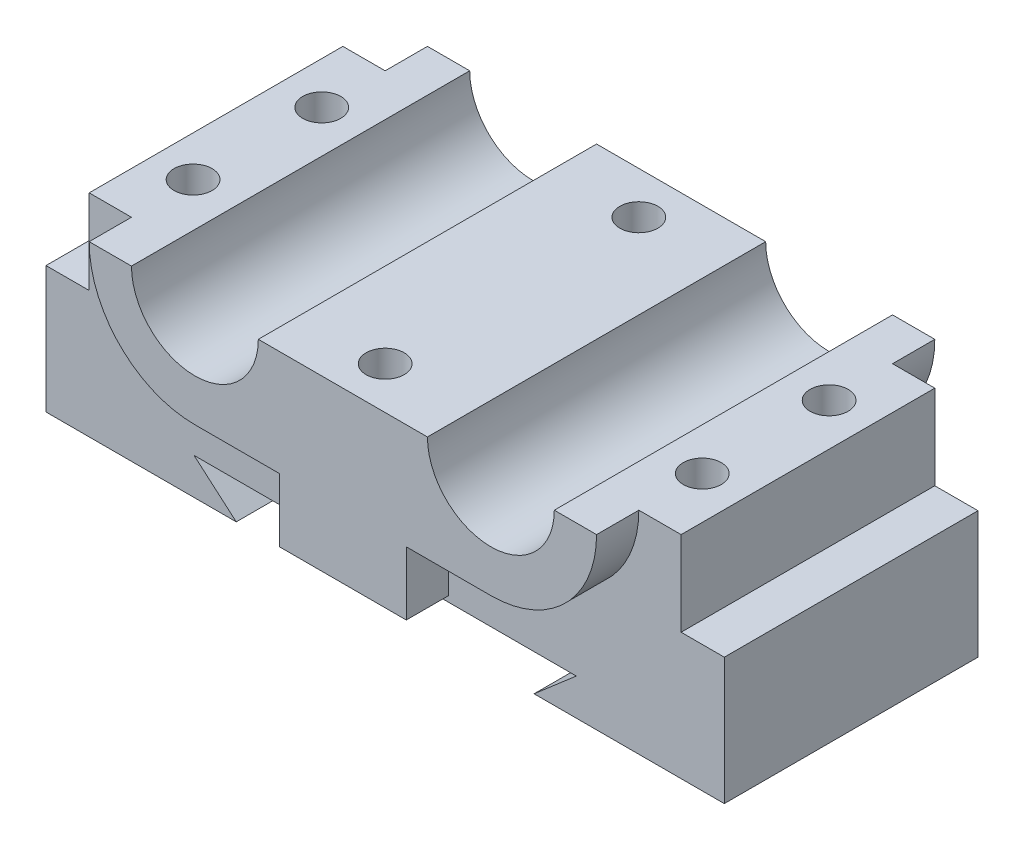
from build123d import *

# Parameters (mm, degrees)
BOSS_EXTRUDE1_DEPTH       = 20
BOSS_EXTRUDE2_DEPTH       = 15
F_3_0MM_DOWEL_HOLE1_D     = 4.5
F_3_0MM_DOWEL_HOLE1_DEPTH = 15
F_3_0MM_DOWEL_HOLE1_TIP   = 1.351936393


with BuildPart() as part:
    # Sketch1 → Boss-Extrude1 (new, symmetric)
    with BuildSketch(Plane.XY):
        with BuildLine():
            Line((-30, 0), (-25, 0))
            ThreePointArc((-25, 0), (-17.5, -7.5), (-10, 0))
            Line((-10, 0), (10, 0))
            ThreePointArc((10, 0), (17.5, -7.5), (25, 0))
            Line((25, 0), (30, 0))
            ThreePointArc((30, 0), (26.338834765, -8.838834765), (17.5, -12.5))
            Line((17.5, -12.5), (7.5, -12.5))
            Line((7.5, -12.5), (7.5, -20))
            Line((7.5, -20), (-7.5, -20))
            Line((-7.5, -20), (-7.5, -12.5))
            Line((-7.5, -12.5), (-17.5, -12.5))
            ThreePointArc((-17.5, -12.5), (-26.338834765, -8.838834765), (-30, 0))
        make_face()
    extrude(amount=BOSS_EXTRUDE1_DEPTH, both=True)

    # Sketch6 → Boss-Extrude2 (add, symmetric)
    with BuildSketch(Plane.XY):
        with BuildLine():
            Line((-35, 0), (-35, -10))
            Line((-35, -10), (-40.106769961, -10))
            Line((-40.106769961, -10), (-40.106769961, -25))
            Line((-40.106769961, -25), (-17.606769961, -25))
            Line((-17.606769961, -25), (-22.606769961, -20.683563485))
            Line((-22.606769961, -20.683563485), (22.606769961, -20.683563485))
            Line((22.606769961, -20.683563485), (17.606769961, -25))
            Line((17.606769961, -25), (40.106769961, -25))
            Line((40.106769961, -25), (40.106769961, -10))
            Line((40.106769961, -10), (35, -10))
            Line((35, -10), (35, 0))
            Line((35, 0), (30, 0))
            ThreePointArc((30, 0), (26.338834765, -8.838834765), (17.5, -12.5))
            Line((17.5, -12.5), (7.5, -12.5))
            Line((7.5, -12.5), (7.5, -20))
            Line((7.5, -20), (-7.5, -20))
            Line((-7.5, -20), (-7.5, -12.5))
            Line((-7.5, -12.5), (-17.5, -12.5))
            ThreePointArc((-17.5, -12.5), (-26.338834765, -8.838834765), (-30, 0))
            Line((-30, 0), (-35, 0))
        make_face()
    extrude(amount=BOSS_EXTRUDE2_DEPTH, both=True)

    # Ø3.0mm Dowel Hole1
    with Locations(Plane(origin=(0, 0, 0), x_dir=(1, 0, 0), z_dir=(0, 1, 0))):
        with Locations((0, 15), (0, -15), (30, 7.5), (30, -7.5), (-30, 7.5), (-30.215711777, -7.5)):
            Hole(F_3_0MM_DOWEL_HOLE1_D / 2, depth=F_3_0MM_DOWEL_HOLE1_DEPTH)
            with Locations((0, 0, -(F_3_0MM_DOWEL_HOLE1_DEPTH + F_3_0MM_DOWEL_HOLE1_TIP / 2))):  # 118° drill point
                Cone(0, F_3_0MM_DOWEL_HOLE1_D / 2, F_3_0MM_DOWEL_HOLE1_TIP, mode=Mode.SUBTRACT)


solid = part.part
